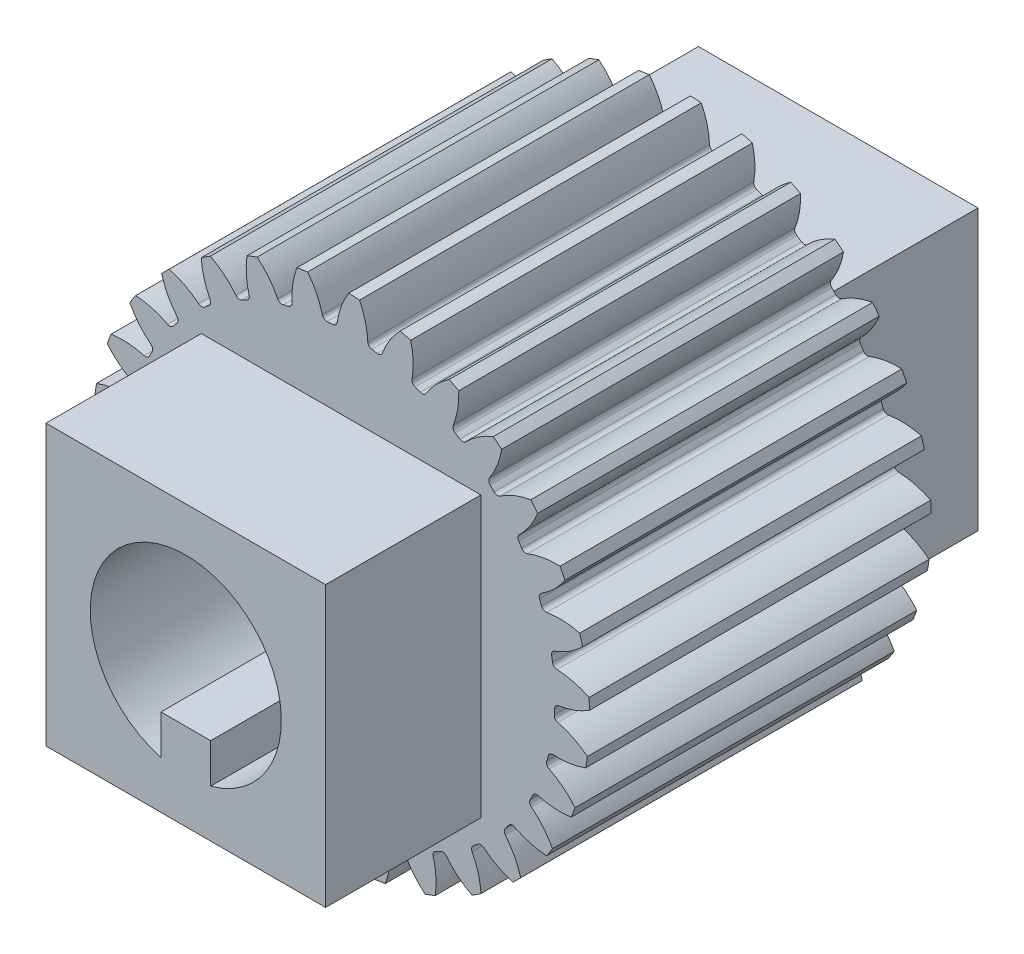
from build123d import *

# Parameters (mm, degrees)
CROQUIS1_R              = 16
SALIENTE_EXTRUIR1_DEPTH = 22
CORTAR_EXTRUIR2_START   = -22
CORTAR_EXTRUIR2_DEPTH   = 22
MATRIZC2_COUNT          = 30
CROQUIS5_W              = 18
CROQUIS5_H              = 18
SALIENTE_EXTRUIR2_DEPTH = 21
CROQUIS8_R              = 6.15
CORTAR_EXTRUIR3_DEPTH   = 48.702442513
SALIENTE_EXTRUIR6_DEPTH = 42


with BuildPart() as part:
    # Croquis1 → Saliente-Extruir1 (new body)
    with BuildSketch(Plane.XY):
        Circle(CROQUIS1_R)
    extrude(amount=SALIENTE_EXTRUIR1_DEPTH)

    # Croquis3 → Cortar-Extruir2 (cut)
    with BuildSketch(Plane.XY.offset(22).offset(CORTAR_EXTRUIR2_START)):
        with BuildLine():
            ThreePointArc((0.488149146, 15.992551717), (-0.837579411, 15.978061858), (-2.157556918, 15.853862247))
            ThreePointArc((-2.157556918, 15.853862247), (-1.583788595, 14.949252698), (-1.210382024, 13.94521283))
            ThreePointArc((-1.210382024, 13.94521283), (-1.095810711, 13.776905502), (-0.900176832, 13.720502238))
            ThreePointArc((-0.900176832, 13.720502238), (-0.719794806, 13.731146909), (-0.539288471, 13.739420219))
            ThreePointArc((-0.539288471, 13.739420219), (-0.350623998, 13.815968628), (-0.254277808, 13.995332376))
            ThreePointArc((-0.254277808, 13.995332376), (0.01210595, 15.03291043), (0.488149146, 15.992551717))
        make_face()
    cortar_extruir2 = extrude(amount=CORTAR_EXTRUIR2_DEPTH, mode=Mode.SUBTRACT)

    # MatrizC2: Cortar-Extruir2 ×30 about axis
    matrizc2_axis = Axis((0, 0, 0), (0, 0, 1))
    for i in range(1, MATRIZC2_COUNT):
        add(cortar_extruir2.rotate(matrizc2_axis, i * 360 / MATRIZC2_COUNT), mode=Mode.SUBTRACT)

    # Croquis5 → Saliente-Extruir2 (add, symmetric)
    with BuildSketch(Plane(origin=(0, 0, 11), x_dir=(-1, 0, 0), z_dir=(0, 0, -1))):
        Rectangle(CROQUIS5_W, CROQUIS5_H)
    extrude(amount=SALIENTE_EXTRUIR2_DEPTH, both=True)

    # Croquis8 → Cortar-Extruir3 (cut, through all)
    with BuildSketch(Plane(origin=(0, 0, -10), x_dir=(-1, 0, 0), z_dir=(0, 0, -1))):
        Circle(CROQUIS8_R)
    extrude(amount=-CORTAR_EXTRUIR3_DEPTH, mode=Mode.SUBTRACT)

    # Croquis9 → Saliente-Extruir6 (add)
    with BuildSketch(Plane(origin=(0, 0, -10), x_dir=(-1, 0, 0), z_dir=(0, 0, -1))):
        with BuildLine():
            Line((-1.6, -3.4), (-1.6, -5.93822364))
            ThreePointArc((-1.6, -5.93822364), (0, -6.15), (1.6, -5.93822364))
            Line((1.6, -5.93822364), (1.6, -3.4))
            Line((1.6, -3.4), (-1.6, -3.4))
        make_face()
    extrude(amount=-SALIENTE_EXTRUIR6_DEPTH)


solid = part.part
